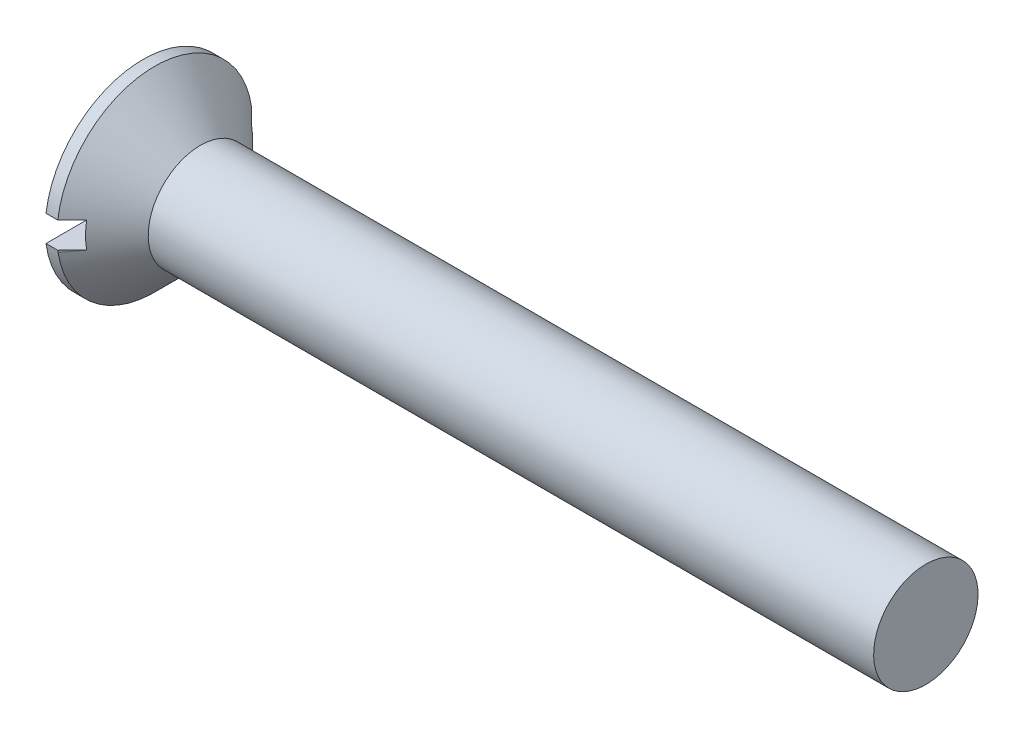
from build123d import *

# Parameters (mm, degrees)
SKETCH2_W          = 7.5
SKETCH2_H          = 1
CUT_EXTRUDE1_DEPTH = 1


with BuildPart() as part:
    # Sketch1 → Revolve1 (revolve)
    with BuildSketch(Plane.XY):
        Polygon((0, 0), (0, 3.75), (0.45, 3.75), (2.2, 2), (30, 2), (30, 0), align=None)
    revolve(axis=Axis((30, 0, 0), (-1, 0, 0)))

    # Sketch2 → Cut-Extrude1 (cut)
    with BuildSketch(Plane.ZY):
        Rectangle(SKETCH2_W, SKETCH2_H)
    extrude(amount=-CUT_EXTRUDE1_DEPTH, mode=Mode.SUBTRACT)


solid = part.part
